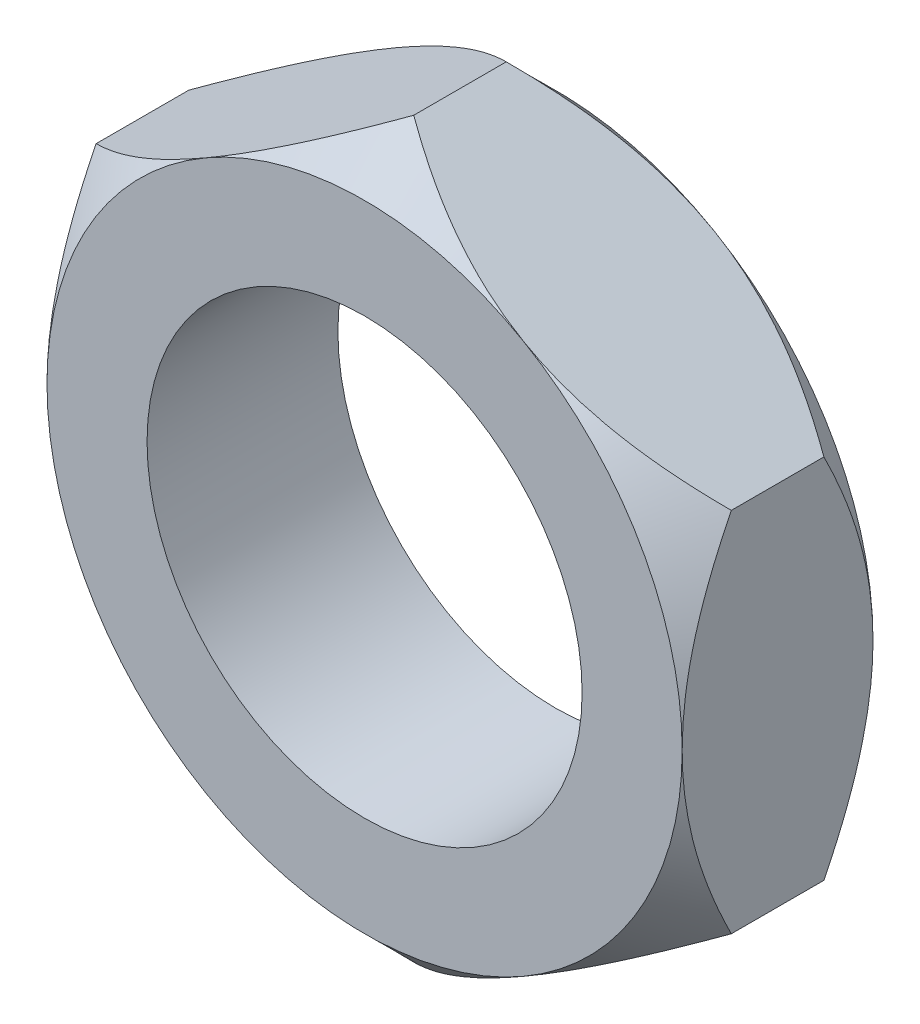
from build123d import *

# Parameters (mm, degrees)
SKETCH1_R               = 7.5
BOSS_EXTRUDE1_DEPTH     = 6.58
SKETCH2_OUTSIDE_W       = 43.878
SKETCH2_OUTSIDE_H       = 47.266
SKETCH2_OUTSIDE_R       = 10.95
CUT_EXTRUDE1_DEPTH      = 6.58
CUT_EXTRUDE1_DRAFT      = -45
MIRROR1_COPY_1_SKETCH_W = 43.878
MIRROR1_COPY_1_SKETCH_H = 47.266
MIRROR1_COPY_1_SKETCH_R = 10.95
MIRROR1_COPY_1_DEPTH    = 6.58
MIRROR1_COPY_1_DRAFT    = -45


with BuildPart() as part:
    # Sketch1 → Boss-Extrude1 (new body)
    with BuildSketch(Plane.XY):
        Polygon((0, 12.643970895), (-10.95, 6.321985448), (-10.95, -6.321985448), (0, -12.643970895), (10.95, -6.321985448), (10.95, 6.321985448), align=None)
        with Locations(Location((0, 0, 0), (0, 0, 180))):
            Circle(SKETCH1_R, mode=Mode.SUBTRACT)
    extrude(amount=BOSS_EXTRUDE1_DEPTH)


with BuildPart() as cut_extrude1_tool:
    # Sketch2 outside → Cut-Extrude1 (with draft: the straight prism first)
    with BuildSketch(Plane.XY.offset(6.58)):
        Rectangle(SKETCH2_OUTSIDE_W, SKETCH2_OUTSIDE_H)
        Circle(SKETCH2_OUTSIDE_R, mode=Mode.SUBTRACT)
    extrude(amount=-CUT_EXTRUDE1_DEPTH)
    # Cut-Extrude1: the draft: its side faces are tilted about the plane it starts from
    cut_extrude1_sides = [cut_extrude1_tool.faces().sort_by_distance(p)[0] for p in [
        (0, -23.633, 3.29),
        (21.939, 0, 3.29),
        (0, 23.633, 3.29),
        (-21.939, 0, 3.29),
        (-10.95, 0, 3.29),
    ]]
    draft(cut_extrude1_sides, Plane.XY.offset(6.58), CUT_EXTRUDE1_DRAFT)


with BuildPart() as part_1:
    add(part.part)

    # Cut-Extrude1: cut by cut_extrude1_tool
    add(cut_extrude1_tool.part, mode=Mode.SUBTRACT)


with BuildPart() as mirror1_copy_1_tool:
    # Mirror1 copy 1 sketch → Mirror1 copy 1 (with draft: the straight prism first)
    with BuildSketch(Plane(origin=(0, 0, 0), x_dir=(1, 0, 0), z_dir=(0, 0, -1))):
        Rectangle(MIRROR1_COPY_1_SKETCH_W, MIRROR1_COPY_1_SKETCH_H)
        Circle(MIRROR1_COPY_1_SKETCH_R, mode=Mode.SUBTRACT)
    extrude(amount=-MIRROR1_COPY_1_DEPTH)
    # Mirror1 copy 1: the draft: its side faces are tilted about the plane it starts from
    mirror1_copy_1_sides = [mirror1_copy_1_tool.faces().sort_by_distance(p)[0] for p in [
        (0, -23.633, 3.29),
        (21.939, 0, 3.29),
        (0, 23.633, 3.29),
        (-21.939, 0, 3.29),
        (-10.95, 0, 3.29),
    ]]
    draft(mirror1_copy_1_sides, Plane(origin=(0, 0, 0), x_dir=(1, 0, 0), z_dir=(0, 0, -1)), MIRROR1_COPY_1_DRAFT)


with BuildPart() as part_2:
    add(part_1.part)

    # Mirror1 copy 1: cut by mirror1_copy_1_tool
    add(mirror1_copy_1_tool.part, mode=Mode.SUBTRACT)


solid = part_2.part
